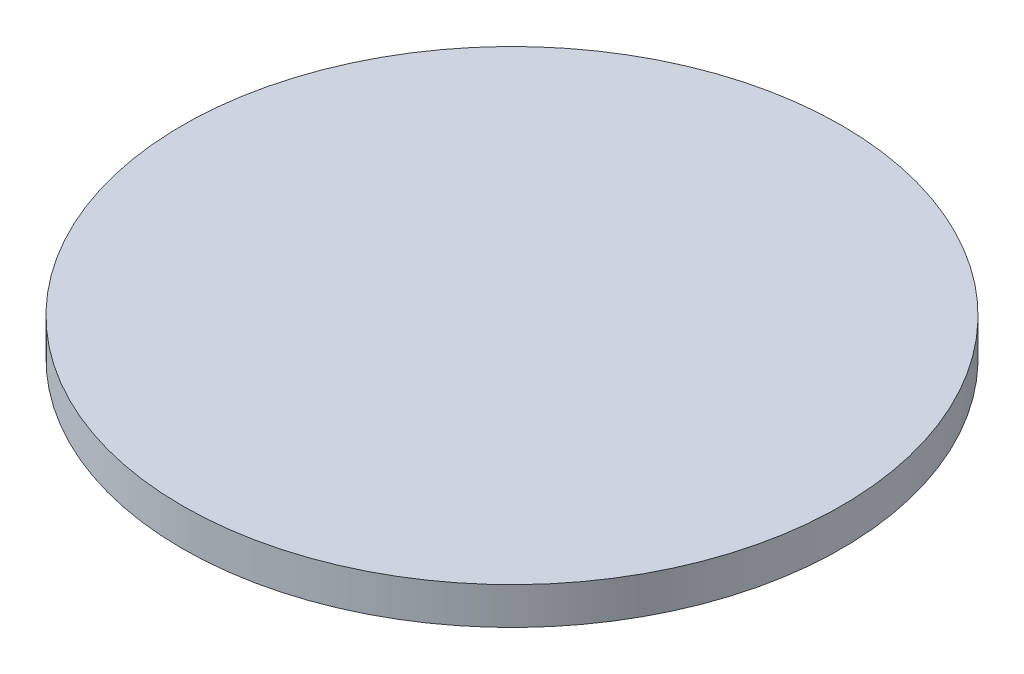
from build123d import *

# Parameters (mm, degrees)
SKETCH1_R           = 85.725
BOSS_EXTRUDE1_DEPTH = 4.826


with BuildPart() as part:
    # Sketch1 → Boss-Extrude1 (new, symmetric)
    with BuildSketch(Plane(origin=(0, 0, 0), x_dir=(1, 0, 0), z_dir=(0, 1, 0))):
        with Locations(Location((0, 0, 0), (0, 0, 270))):
            Circle(SKETCH1_R)
    extrude(amount=BOSS_EXTRUDE1_DEPTH, both=True)


solid = part.part
